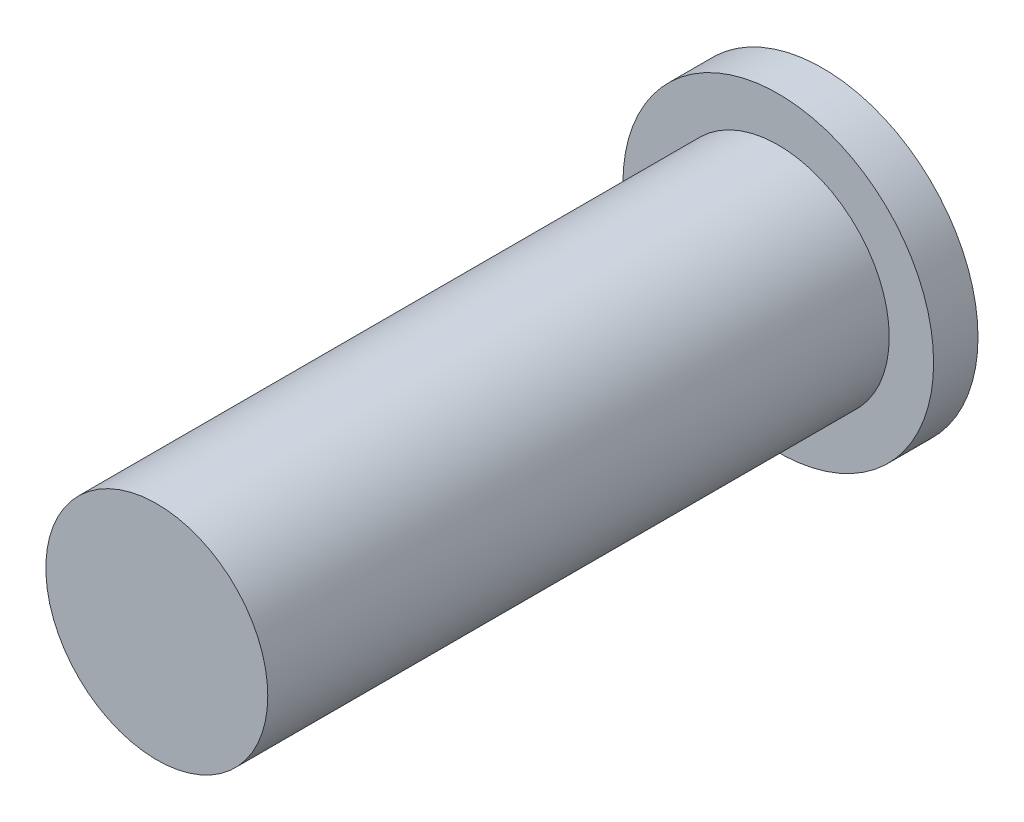
from build123d import *


with BuildPart() as part:
    # Schizzo2 → Rivoluzione1 (revolve)
    with BuildSketch(Plane(origin=(0, 0, 0), x_dir=(0, 0, -1), z_dir=(1, 0, 0)), mode=Mode.PRIVATE) as rivoluzione1_sk:
        Polygon((0, 2.5), (0, 0), (15, 0), (15, 2.5), (15, 3.5), (14, 3.5), (14, 2.5), align=None)
    revolve(rivoluzione1_sk.sketch.rotate(Axis((0, 0, 0), (0, 0, -1)), 90), axis=Axis((0, 0, 0), (0, 0, -1)))


solid = part.part
